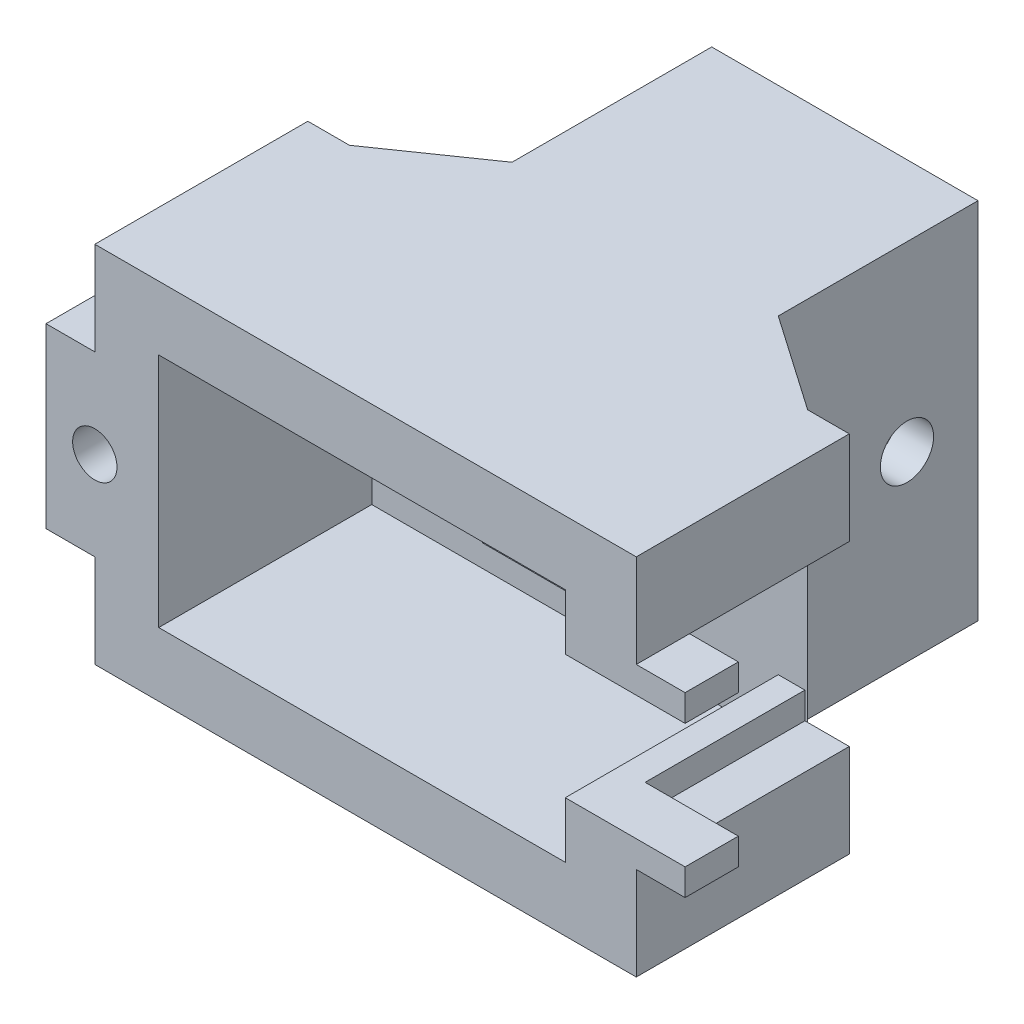
from build123d import *

# Parameters (mm, degrees)
SKETCH_2_W           = 30.5
SKETCH_2_H           = 20.5
SKETCH_2_W_2         = 22.5
SKETCH_2_H_2         = 12.5
EXTRUDE_1_DEPTH      = 12
SKETCH_3_W           = 2.75
SKETCH_3_H           = 10
EXTRUDE_2_DEPTH      = 3
SKETCH_4_W           = 4.940698383
SKETCH_4_H           = 10
CUT_EXTRUDE_1_DEPTH  = 9
SKETCH_7_R           = 1.25
CUT_EXTRUDE_2_DEPTH  = 23.584563312
SKETCH_12_W          = 15
SKETCH_12_H          = 20.5
EXTRUDE_5_DEPTH      = 15
SKETCH_13_W          = 10
SKETCH_13_H          = 10
CUT_EXTRUDE_6_DEPTH  = 12
EXTRUDE_7_REACH      = 33.133
SKETCH_15_R          = 1.5
CUT_EXTRUDE_7_DEPTH  = 32.30994251
SKETCH_16_W          = 10.43035396
SKETCH_16_H          = 7
CUT_EXTRUDE_8_DEPTH  = 23
CUT_EXTRUDE_9_REACH  = 36.03
SKETCH_17_W          = 10.8
SKETCH_17_H          = 10.8
CUT_EXTRUDE_10_REACH = 33.31
SKETCH_19_W          = 22.9
SKETCH_19_H          = 13.3
CUT_EXTRUDE_12_DEPTH = 12


with BuildPart() as part:
    # 草图2 → 凸台-拉伸1 (new body)
    with BuildSketch(Plane.XY):
        Rectangle(SKETCH_2_W, SKETCH_2_H)
        Rectangle(SKETCH_2_W_2, SKETCH_2_H_2, mode=Mode.SUBTRACT)
    extrude(amount=EXTRUDE_1_DEPTH)

    # 草图3 → 凸台-拉伸2 (add)
    with BuildSketch(Plane.XY.offset(12)):
        with Locations((-16.625, 0)):
            Rectangle(SKETCH_3_W, SKETCH_3_H)
    extrude_2 = extrude(amount=-EXTRUDE_2_DEPTH)

    # 镜向1: 凸台-拉伸2 across plane
    add(extrude_2.mirror(Plane(origin=(0, 0, 0), x_dir=(0, 0, 1), z_dir=(1, 0, 0))))

    # 草图4 → 切除-拉伸1 (cut)
    with BuildSketch(Plane(origin=(0, 0, 0), x_dir=(-1, 0, 0), z_dir=(0, 0, -1))):
        with Locations((15.220349192, 0)):
            Rectangle(SKETCH_4_W, SKETCH_4_H)
    cut_extrude_1 = extrude(amount=-CUT_EXTRUDE_1_DEPTH, mode=Mode.SUBTRACT)

    # 镜向2: 切除-拉伸1 across plane
    add(cut_extrude_1.mirror(Plane(origin=(0, 0, 0), x_dir=(0, 0, 1), z_dir=(1, 0, 0))), mode=Mode.SUBTRACT)

    # 草图7 → 切除-拉伸2 (cut, through all)
    with BuildSketch(Plane(origin=(0, 0, 9), x_dir=(-1, 0, 0), z_dir=(0, 0, -1))):
        with Locations((15.25, 0)):
            Circle(SKETCH_7_R)
    extrude(amount=-CUT_EXTRUDE_2_DEPTH, mode=Mode.SUBTRACT)

    # 草图12 → 凸台-拉伸5 (add)
    with BuildSketch(Plane(origin=(0, 0, 0), x_dir=(-1, 0, 0), z_dir=(0, 0, -1))):
        Rectangle(SKETCH_12_W, SKETCH_12_H)
    extrude(amount=EXTRUDE_5_DEPTH)

    # 草图13 → 切除-拉伸6 (cut)
    with BuildSketch(Plane(origin=(0, 0, -15), x_dir=(-1, 0, 0), z_dir=(0, 0, -1))):
        Rectangle(SKETCH_13_W, SKETCH_13_H)
    extrude(amount=-CUT_EXTRUDE_6_DEPTH, mode=Mode.SUBTRACT)

    # 凸台-拉伸7: up to this face of the body (flat: up to its plane)
    extrude_7_end = Plane(part.part.faces().sort_by_distance((0, 10.25, 0.860406091))[0])
    # 草图14 → 凸台-拉伸7 (add, up to the picked face)
    with BuildSketch(Plane.XZ.offset(10.25), mode=Mode.PRIVATE) as extrude_7_sk1:
        Polygon((-7.5, -3.75), (-7.5, 0), (-12.905079067, 0), align=None)
    extrude_7_tool1 = split(extrude(extrude_7_sk1.sketch, amount=-EXTRUDE_7_REACH, mode=Mode.PRIVATE), bisect_by=extrude_7_end, keep=Keep.BOTH, mode=Mode.PRIVATE)
    extrude_7 = extrude_7_tool1.solids().sort_by(Axis((-9.301693, -10.25, -1.25), (0, 1, 0)))[0]
    add(extrude_7)

    # 镜向6: 凸台-拉伸7 across plane
    add(extrude_7.mirror(Plane(origin=(0, 0, 0), x_dir=(0, 0, 1), z_dir=(1, 0, 0))))

    # 草图15 → 切除-拉伸7 (cut, through all)
    with BuildSketch(Plane.ZY.offset(7.5)):
        with Locations((-11, 0)):
            Circle(SKETCH_15_R)
    extrude(amount=-CUT_EXTRUDE_7_DEPTH, mode=Mode.SUBTRACT)

    # 草图16 → 切除-拉伸8 (cut)
    with BuildSketch(Plane.XY):
        with Locations((16.46517698, 0)):
            Rectangle(SKETCH_16_W, SKETCH_16_H)
    extrude(amount=CUT_EXTRUDE_8_DEPTH, mode=Mode.SUBTRACT)

    # 草图17 → 切除-拉伸9 (cut, up to next)
    with BuildSketch(Plane(origin=(0, 0, -15), x_dir=(-1, 0, 0), z_dir=(0, 0, -1)), mode=Mode.PRIVATE) as cut_extrude_9_sk1:
        Rectangle(SKETCH_17_W, SKETCH_17_H)
    cut_extrude_9_tool1 = extrude(cut_extrude_9_sk1.sketch, amount=-CUT_EXTRUDE_9_REACH, mode=Mode.PRIVATE) & part.part
    add(cut_extrude_9_tool1.solids().sort_by_distance((0, 0, -15))[0], mode=Mode.SUBTRACT)

    # 草图18 → 切除-拉伸10 (cut, up to next)
    with BuildSketch(Plane.ZY.offset(7.5), mode=Mode.PRIVATE) as cut_extrude_10_sk1:
        Polygon((-9.267949192, 3), (-12.732050808, 3), (-14.464101615, 0), (-12.732050808, -3), (-9.267949192, -3), (-7.535898385, 0), align=None)
    cut_extrude_10_tool1 = extrude(cut_extrude_10_sk1.sketch, amount=-CUT_EXTRUDE_10_REACH, mode=Mode.PRIVATE) & part.part
    add(cut_extrude_10_tool1.solids().sort_by_distance((-7.5, 0, -11))[0], mode=Mode.SUBTRACT)

    # 草图19 → 切除-拉伸12 (cut)
    with BuildSketch(Plane.XY.offset(12)):
        with Locations((-0.2, 0)):
            Rectangle(SKETCH_19_W, SKETCH_19_H)
    extrude(amount=-CUT_EXTRUDE_12_DEPTH, mode=Mode.SUBTRACT)


solid = part.part
